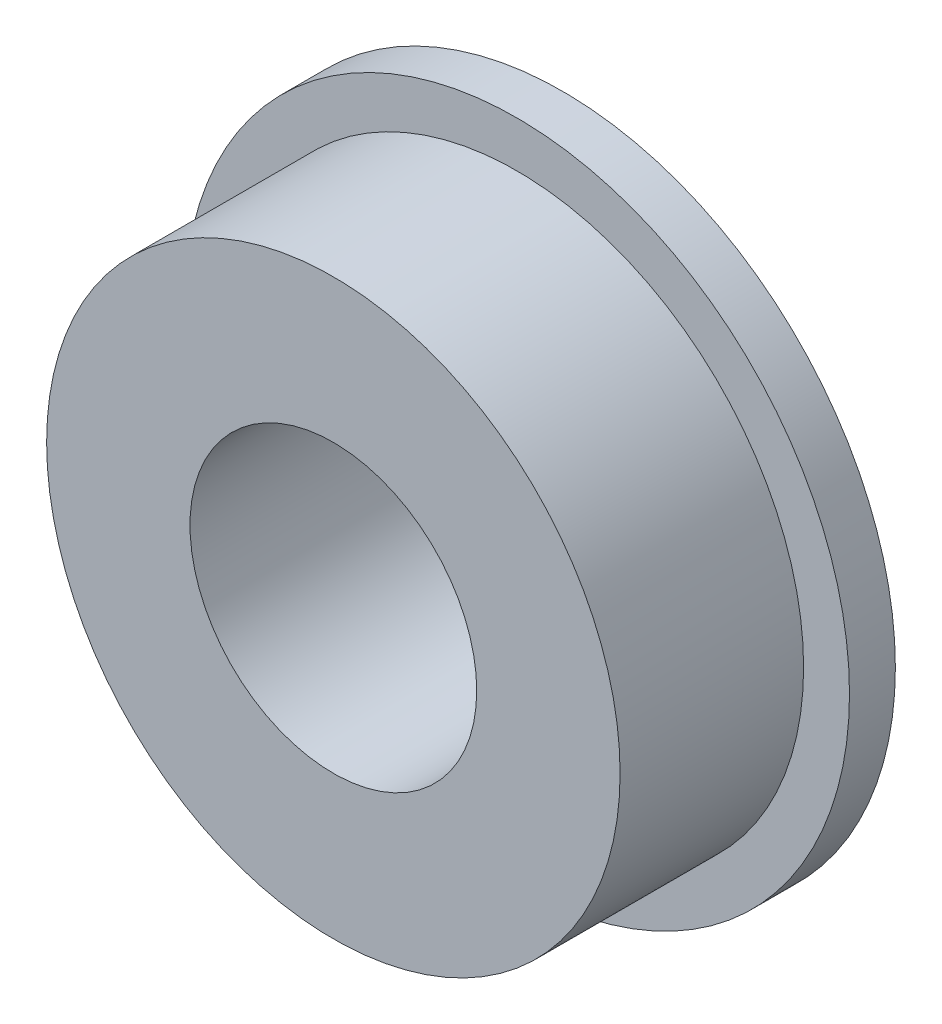
from build123d import *

# Parameters (mm, degrees)
SKETCH_1_R      = 5
SKETCH_1_R_2    = 2.5
EXTRUDE_1_DEPTH = 4
SKETCH_1_3_R    = 5.8
SKETCH_1_3_R_2  = 5
EXTRUDE_2_DEPTH = 0.8


with BuildPart() as part:
    # 草图1 → 凸台-拉伸1 (new body)
    with BuildSketch(Plane.XY):
        Circle(SKETCH_1_R)
        Circle(SKETCH_1_R_2, mode=Mode.SUBTRACT)
    extrude(amount=EXTRUDE_1_DEPTH)

    # 草图1<3> → 凸台-拉伸2 (add)
    with BuildSketch(Plane.XY):
        Circle(SKETCH_1_3_R)
        Circle(SKETCH_1_3_R_2, mode=Mode.SUBTRACT)
    extrude(amount=EXTRUDE_2_DEPTH)


solid = part.part
